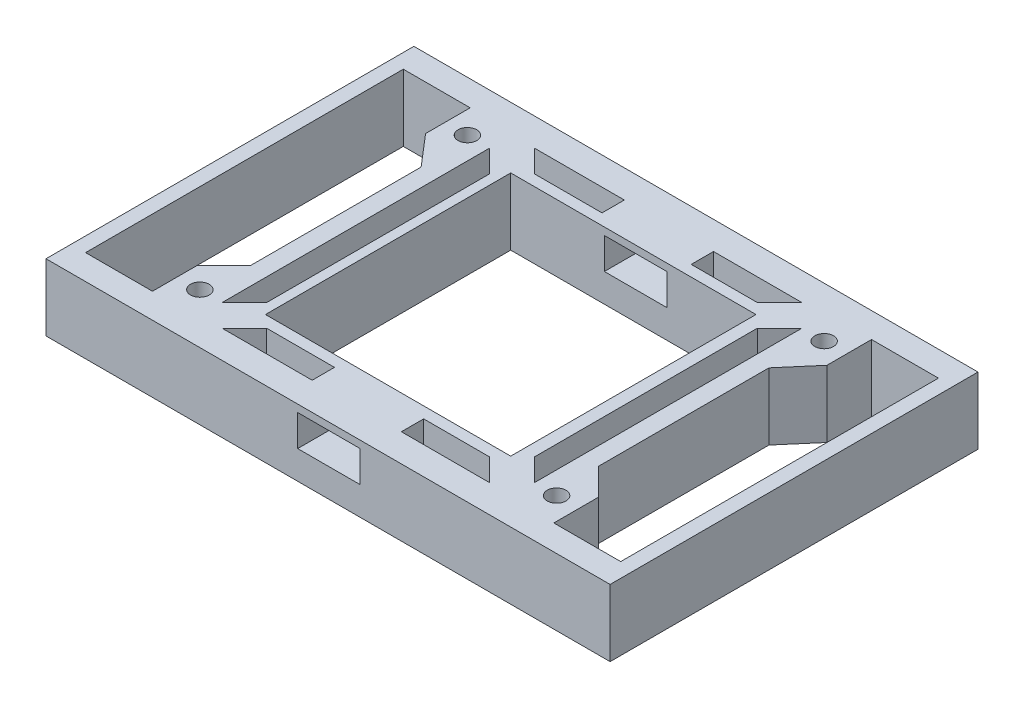
from build123d import *

# Parameters (mm, degrees)
SKETCH_1_R               = 2.1
SKETCH_1_W               = 60
SKETCH_1_H               = 60
SKETCH_1_W_2             = 55
SKETCH_1_H_2             = 55
EXTRUDE_1_DEPTH          = 15
CUT_EXTRUDE_1_DEPTH      = 160.024864418
CUT_EXTRUDE_1_DEPTH_BACK = 160.024864418
CUT_EXTRUDE_2_DEPTH      = 184.645620758
CUT_EXTRUDE_2_DEPTH_BACK = 184.645620758


with BuildPart() as part:
    # Эскиз1 → Бобышка-Вытянуть1 (new body)
    # profile 1 of 13: a face of its own
    with BuildSketch(Plane(origin=(0, 45.645974268, 0), x_dir=(-1, 0, 0), z_dir=(0, -1, 0))):
        Polygon((-109.808980694, -130.773129836), (-128.058980694, -130.773129836), (-128.058980694, -48.273129836), (-109.808980694, -48.273129836), (-109.808980694, -53.898129836), (-124.808980694, -53.898129836), (-124.808980694, -125.148129836), (-109.808980694, -125.148129836), align=None)
    # profile 2 of 13: a face of its own
    with BuildSketch(Plane(origin=(0, 45.645974268, 0), x_dir=(-1, 0, 0), z_dir=(0, -1, 0))):
        Polygon((-109.808980694, -130.773129836), (-99.808980694, -130.773129836), (-99.808980694, -124.523129836), (-99.808980694, -119.523129836), (-99.808980694, -95.523129836), (-99.808980694, -83.523129836), (-99.808980694, -59.523129836), (-99.808980694, -54.523129836), (-99.808980694, -48.273129836), (-109.808980694, -48.273129836), (-109.808980694, -53.898129836), (-109.808980694, -125.148129836), align=None)
        with Locations(Location((-104.808980694, -119.523129836, 0), (0, 0, 90))):
            Circle(SKETCH_1_R, mode=Mode.SUBTRACT)
        with Locations(Location((-104.808980694, -59.523129836, 0), (0, 0, 90))):
            Circle(SKETCH_1_R, mode=Mode.SUBTRACT)
    # profile 3 of 13: a face of its own
    with BuildSketch(Plane(origin=(0, 45.645974268, 0), x_dir=(-1, 0, 0), z_dir=(0, -1, 0))):
        with Locations((-64.808980694, -89.523129836)):
            Rectangle(SKETCH_1_W, SKETCH_1_H)
        with Locations((-64.5, -89.5)):
            Rectangle(SKETCH_1_W_2, SKETCH_1_H_2, mode=Mode.SUBTRACT)
    # profile 4 of 13: a face of its own
    with BuildSketch(Plane(origin=(0, 45.645974268, 0), x_dir=(-1, 0, 0), z_dir=(0, -1, 0))):
        Polygon((-64.808980694, -124.523129836), (-55, -124.523129836), (-55, -119.523129836), (-75, -119.523129836), (-75, -124.523129836), align=None)
    # profile 5 of 13: a face of its own
    with BuildSketch(Plane(origin=(0, 45.645974268, 0), x_dir=(-1, 0, 0), z_dir=(0, -1, 0))):
        Polygon((-99.808980694, -130.773129836), (-99.808980694, -124.523129836), (-64.808980694, -124.523129836), (-29.808980694, -124.523129836), (-29.808980694, -130.773129836), align=None)
    # profile 6 of 13: a face of its own
    with BuildSketch(Plane(origin=(0, 45.645974268, 0), x_dir=(-1, 0, 0), z_dir=(0, -1, 0))):
        Polygon((-99.808980694, -54.523129836), (-99.808980694, -48.273129836), (-29.808980694, -48.273129836), (-29.808980694, -54.523129836), (-64.808980694, -54.523129836), align=None)
    # profile 7 of 13: a face of its own
    with BuildSketch(Plane(origin=(0, 45.645974268, 0), x_dir=(-1, 0, 0), z_dir=(0, -1, 0))):
        Polygon((-29.808980694, -130.773129836), (-29.808980694, -124.523129836), (-29.808980694, -54.523129836), (-29.808980694, -48.273129836), (-19.808980694, -48.273129836), (-19.808980694, -53.898129836), (-19.808980694, -125.148129836), (-19.808980694, -130.773129836), align=None)
        with Locations(Location((-24.808980694, -119.523129836, 0), (0, 0, 90))):
            Circle(SKETCH_1_R, mode=Mode.SUBTRACT)
        with Locations(Location((-24.808980694, -59.523129836, 0), (0, 0, 90))):
            Circle(SKETCH_1_R, mode=Mode.SUBTRACT)
    # profile 8 of 13: a face of its own
    with BuildSketch(Plane(origin=(0, 45.645974268, 0), x_dir=(-1, 0, 0), z_dir=(0, -1, 0))):
        Polygon((-4.808980694, -125.148129836), (-4.808980694, -53.898129836), (-19.808980694, -53.898129836), (-19.808980694, -48.273129836), (-1.558980694, -48.273129836), (-1.558980694, -130.773129836), (-19.808980694, -130.773129836), (-19.808980694, -125.148129836), align=None)
    # profile 9 of 13: a face of its own
    with BuildSketch(Plane(origin=(0, 45.645974268, 0), x_dir=(-1, 0, 0), z_dir=(0, -1, 0))):
        Polygon((-99.808980694, -119.523129836), (-99.808980694, -124.523129836), (-94.808980694, -124.523129836), (-89.808980694, -119.523129836), (-94.808980694, -119.523129836), (-94.808980694, -114.523129836), align=None)
    # profile 10 of 13: a face of its own
    with BuildSketch(Plane(origin=(0, 45.645974268, 0), x_dir=(-1, 0, 0), z_dir=(0, -1, 0))):
        Polygon((-34.808980694, -124.523129836), (-29.808980694, -124.523129836), (-29.808980694, -119.523129836), (-34.808980694, -114.523129836), (-34.808980694, -119.523129836), (-39.808980694, -119.523129836), align=None)
    # profile 11 of 13: a face of its own
    with BuildSketch(Plane(origin=(0, 45.645974268, 0), x_dir=(-1, 0, 0), z_dir=(0, -1, 0))):
        Polygon((-34.808980694, -64.523129836), (-29.808980694, -59.523129836), (-29.808980694, -54.523129836), (-34.808980694, -54.523129836), (-39.808980694, -59.523129836), (-34.808980694, -59.523129836), align=None)
    # profile 12 of 13: a face of its own
    with BuildSketch(Plane(origin=(0, 45.645974268, 0), x_dir=(-1, 0, 0), z_dir=(0, -1, 0))):
        Polygon((-99.808980694, -54.523129836), (-99.808980694, -59.523129836), (-94.808980694, -64.523129836), (-94.808980694, -59.523129836), (-89.808980694, -59.523129836), (-94.808980694, -54.523129836), align=None)
    # profile 13 of 13: a face of its own
    with BuildSketch(Plane(origin=(0, 45.645974268, 0), x_dir=(-1, 0, 0), z_dir=(0, -1, 0))):
        Polygon((-55, -59.523129836), (-55, -54.523129836), (-64.808980694, -54.523129836), (-75, -54.523129836), (-75, -59.523129836), align=None)
    extrude(amount=EXTRUDE_1_DEPTH)

    # Эскиз2 → Вырез-Вытянуть1 (cut, two sides: drawn at the far end of the back side and taken through both)
    with BuildSketch(Plane.XY.offset(130.773129836).offset(-CUT_EXTRUDE_1_DEPTH_BACK)):
        Polygon((64.808980694, 44), (72, 44), (72, 37), (58, 37), (58, 44), align=None)
    extrude(amount=CUT_EXTRUDE_1_DEPTH + CUT_EXTRUDE_1_DEPTH_BACK, mode=Mode.SUBTRACT)

    # Эскиз3 → Вырез-Вытянуть2 (cut, two sides: drawn at the far end of the back side and taken through both)
    with BuildSketch(Plane(origin=(0, 45.645974268, 0), x_dir=(1, 0, 0), z_dir=(0, 1, 0)).offset(-CUT_EXTRUDE_2_DEPTH_BACK)):
        Polygon((103.808980694, -70.898129836), (103.808980694, -109.148129836), (109.808980694, -115.148129836), (109.808980694, -63.898129836), align=None)
        Polygon((25.808980694, -70.898129836), (25.808980694, -109.148129836), (19.808980694, -115.148129836), (19.808980694, -63.898129836), align=None)
    extrude(amount=CUT_EXTRUDE_2_DEPTH + CUT_EXTRUDE_2_DEPTH_BACK, mode=Mode.SUBTRACT)


solid = part.part
